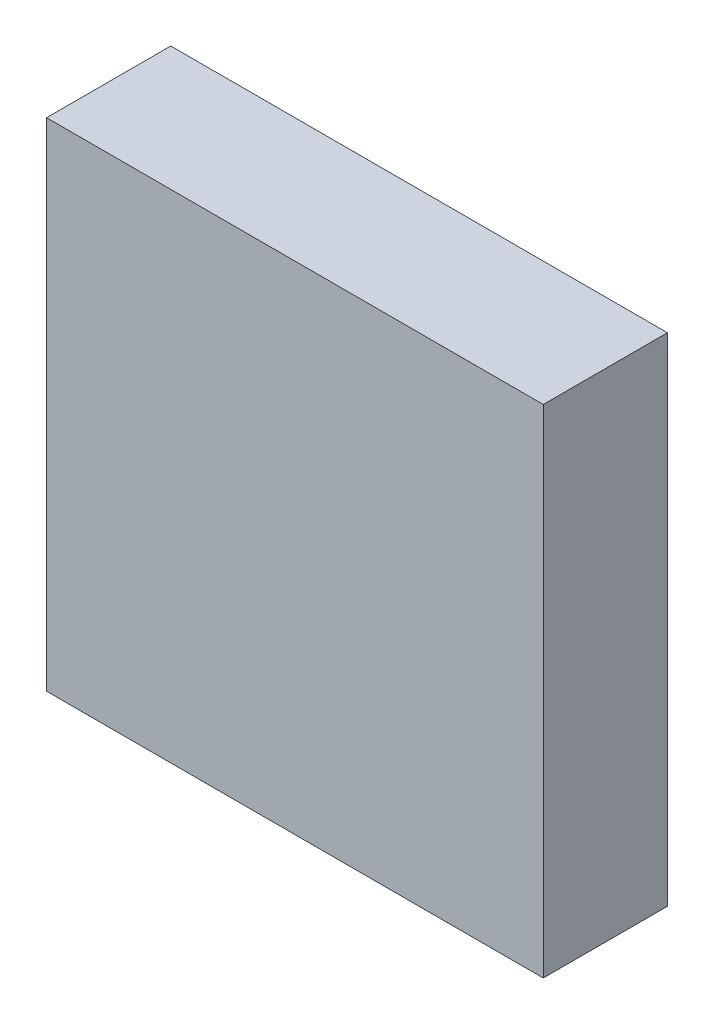
from build123d import *

# Parameters (mm, degrees)
SKETCH1_W           = 120
SKETCH1_H           = 120
BOSS_EXTRUDE1_DEPTH = 30


with BuildPart() as part:
    # Sketch1 → Boss-Extrude1 (new body)
    with BuildSketch(Plane.XY):
        with Locations((60, 60)):
            Rectangle(SKETCH1_W, SKETCH1_H)
    extrude(amount=BOSS_EXTRUDE1_DEPTH)


solid = part.part
